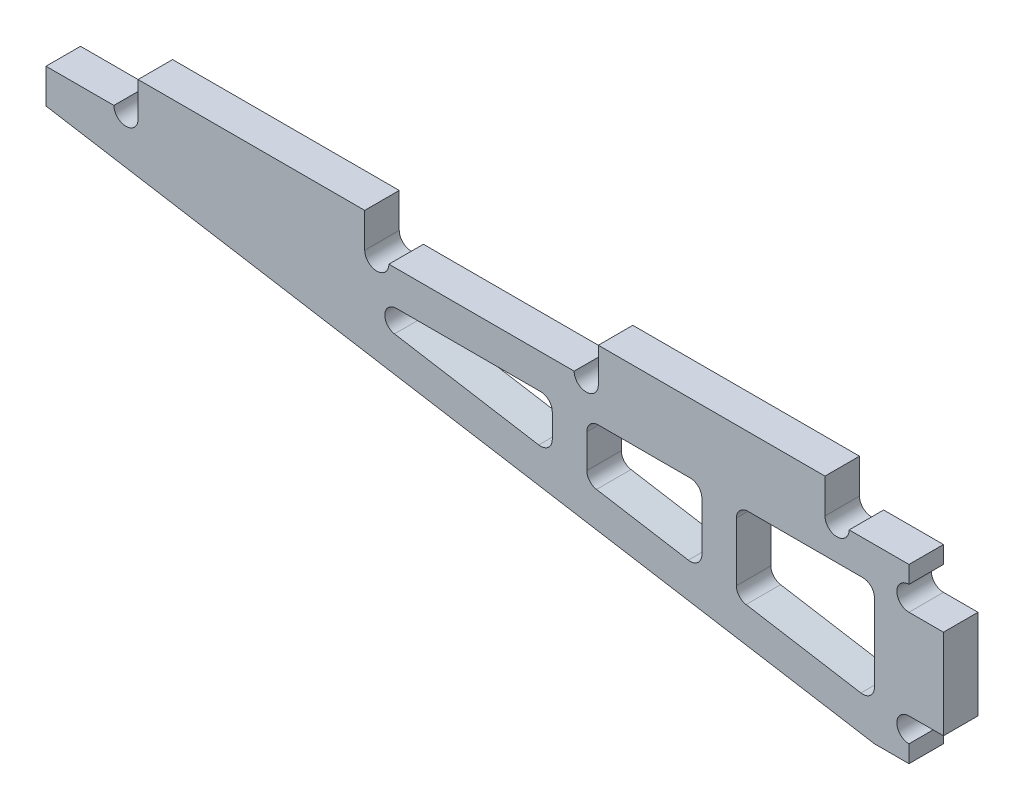
from build123d import *

# Parameters (mm, degrees)
EXTRUDE_1_DEPTH = 3
FILLET_1_R      = 1.01


with BuildPart() as part:
    # 草图1 → 凸台-拉伸1 (new body)
    with BuildSketch(Plane.XY):
        with BuildLine():
            Line((-11.95, -1.5), (-28.05, -1.5))
            ThreePointArc((-28.05, -1.5), (-29.1, -2.55), (-30.15, -1.5))
            Line((-30.15, -1.5), (-30.15, 1.5))
            Line((-30.15, 1.5), (-49.85, 1.5))
            Line((-49.85, 1.5), (-49.85, -1.5))
            ThreePointArc((-49.85, -1.5), (-50.9, -2.55), (-51.95, -1.5))
            Line((-51.95, -1.5), (-57.85, -1.5))
            Line((-57.85, -1.5), (-57.85, -4.5))
            Line((-57.85, -4.5), (14.15, -16.5))
            Line((14.15, -16.5), (17.15, -16.5))
            Line((17.15, -16.5), (17.15, -15))
            ThreePointArc((17.15, -15), (16.1, -13.95), (17.15, -12.9))
            Line((17.15, -12.9), (20.15, -12.9))
            Line((20.15, -12.9), (20.15, -5.1))
            Line((20.15, -5.1), (17.15, -5.1))
            ThreePointArc((17.15, -5.1), (16.1, -4.05), (17.15, -3))
            Line((17.15, -3), (17.15, -1.5))
            Line((17.15, -1.5), (11.95, -1.5))
            ThreePointArc((11.95, -1.5), (10.9, -2.55), (9.85, -1.5))
            Line((9.85, -1.5), (9.85, 1.5))
            Line((9.85, 1.5), (-9.85, 1.5))
            Line((-9.85, 1.5), (-9.85, -1.5))
            ThreePointArc((-9.85, -1.5), (-10.9, -2.55), (-11.95, -1.5))
        make_face()
        Polygon((-10.85, -9.291952068), (-10.85, -4.5), (-0.85, -4.5), (-0.85, -10.958618735), align=None, mode=Mode.SUBTRACT)
        Polygon((2.15, -4.5), (14.15, -4.5), (14.15, -13.458618735), (2.15, -11.458618735), align=None, mode=Mode.SUBTRACT)
        Polygon((-13.85, -8.791952068), (-39.601712409, -4.5), (-13.85, -4.5), align=None, mode=Mode.SUBTRACT)
    extrude(amount=EXTRUDE_1_DEPTH)

    # 圆角1
    fillet_1_edges = [part.edges().sort_by_distance(p)[0] for p in [
        (-0.85, -4.5, 1.5),
        (-10.85, -4.5, 1.5),
        (-10.85, -9.291952068, 1.5),
        (-0.85, -10.958618735, 1.5),
        (2.15, -11.458618735, 1.5),
        (14.15, -13.458618735, 1.5),
        (14.15, -4.5, 1.5),
        (2.15, -4.5, 1.5),
        (-13.85, -4.5, 1.5),
        (-39.601712409, -4.5, 1.5),
        (-13.85, -8.791952068, 1.5),
    ]]
    fillet(fillet_1_edges, radius=FILLET_1_R)


solid = part.part
